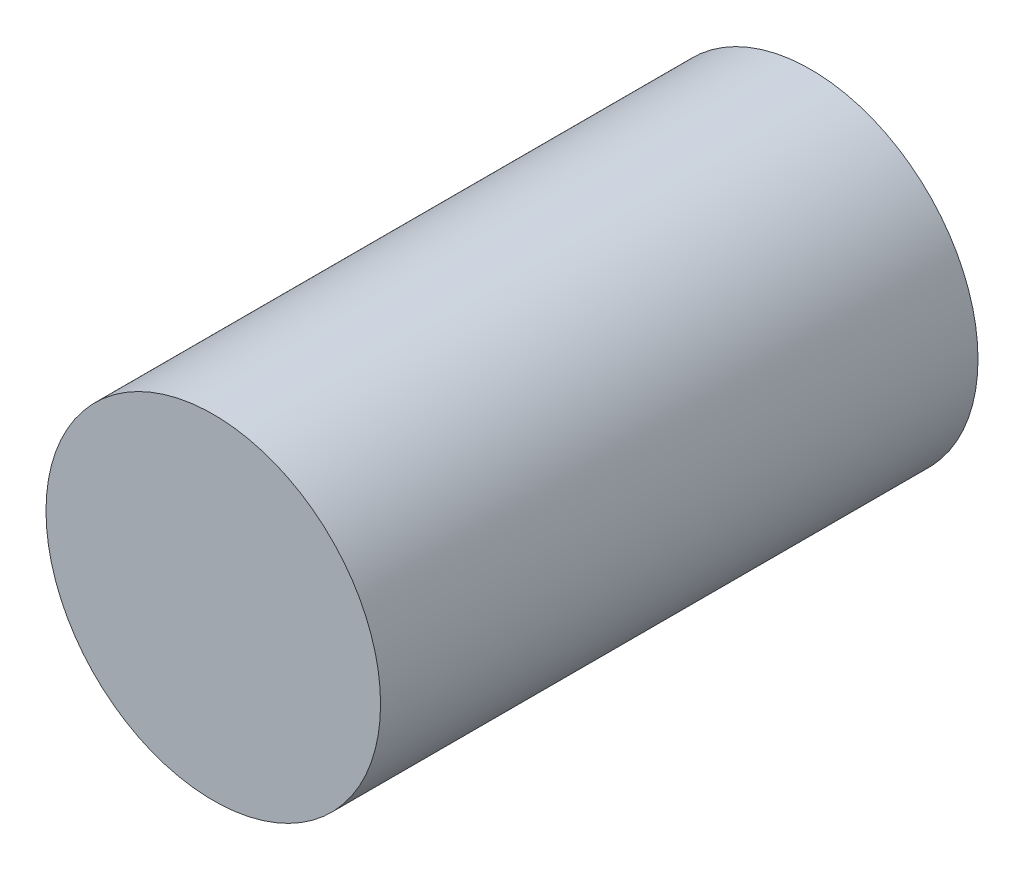
from build123d import *

# Parameters (mm, degrees)
ESQUISSE1_R             = 7
BOSS_EXTRU_1_DEPTH      = 35
ESQUISSE2_R             = 9.801800105
ENL_V_MAT_EXTRU_3_DEPTH = 5
ESQUISSE3_W             = 18.936918968
ESQUISSE3_H             = 14.690308717
ENL_V_MAT_EXTRU_4_DEPTH = 5


with BuildPart() as part:
    # Esquisse1 → Boss.-Extru.1 (new body)
    with BuildSketch(Plane.XY):
        Circle(ESQUISSE1_R)
    extrude(amount=BOSS_EXTRU_1_DEPTH)

    # Esquisse2 → Enlèv. mat.-Extru.3 (cut)
    with BuildSketch(Plane.XY.offset(35)):
        Circle(ESQUISSE2_R)
    extrude(amount=-ENL_V_MAT_EXTRU_3_DEPTH, mode=Mode.SUBTRACT)

    # Esquisse3 → Enlèv. mat.-Extru.4 (cut)
    with BuildSketch(Plane.XY.offset(30)):
        with Locations((-1.419651683, -0.234551147)):
            Rectangle(ESQUISSE3_W, ESQUISSE3_H)
    extrude(amount=-ENL_V_MAT_EXTRU_4_DEPTH, mode=Mode.SUBTRACT)


solid = part.part
